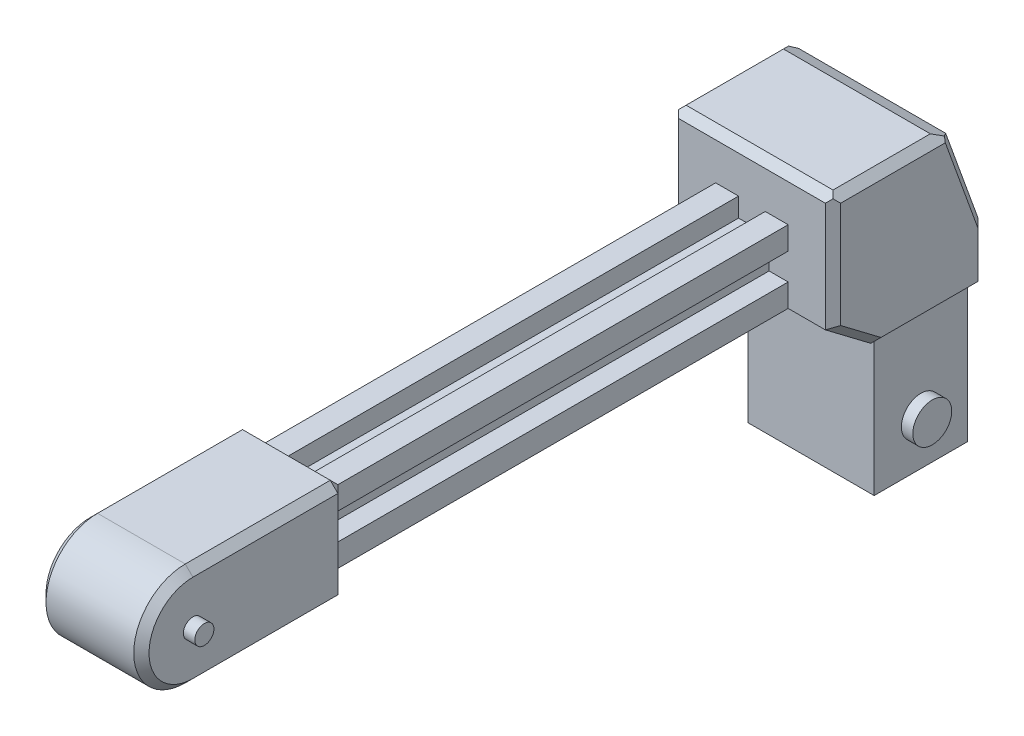
from build123d import *
from OCP.BRepFilletAPI import BRepFilletAPI_MakeChamfer

# Parameters (mm, degrees)
SKETCH_1_W          = 200
SKETCH_1_H          = 19
EXTRUDE_1_DEPTH     = 19
SKETCH_6_W          = 27
SKETCH_6_H          = 27
EXTRUDE_6_DEPTH     = 40
EXTRUDE_7_DEPTH     = 27
SKETCH_8_W          = 42.5
SKETCH_8_H          = 42.5
EXTRUDE_8_DEPTH     = 40
SKETCH_9_R          = 2.5
EXTRUDE_9_DEPTH     = 3
EXTRUDE_START       = 3
SKETCH_10_R         = 2.5
EXTRUDE_10_DEPTH    = 3
SKETCH_11_W         = 33
SKETCH_11_H         = 24.461700173
EXTRUDE_11_DEPTH    = 35
CUT_EXTRUDE_1_REACH = 211.742
CUT_EXTRUDE_2_DEPTH = 42.5
CUT_EXTRUDE_3_REACH = 222.711
SKETCH_15_W         = 120
SKETCH_15_H         = 7
CUT_EXTRUDE_4_DEPTH = 5
SKETCH_16_W         = 120
SKETCH_16_H         = 7
CUT_EXTRUDE_5_DEPTH = 5
SKETCH_17_W         = 7
SKETCH_17_H         = 120
CUT_EXTRUDE_6_DEPTH = 5
SKETCH_18_W         = 7
SKETCH_18_H         = 120
CUT_EXTRUDE_7_DEPTH = 5
CHAMFER_1_SIZE      = 2
CHAMFER_2_SIZE      = 2
CHAMFER_3_SIZE      = 2
CHAMFER_3_SIZE2     = 3.330930275
CHAMFER_4_SIZE      = 2
BOSS_EXTRUDE1_DEPTH = 3
BOSS_EXTRUDE2_START = 3
BOSS_EXTRUDE2_DEPTH = 3


with BuildPart() as part:
    # 草图1 → 凸台-拉伸1 (new body)
    with BuildSketch(Plane(origin=(0, 0, 0), x_dir=(0, 0, -1), z_dir=(1, 0, 0))):
        with Locations((100, 9.5)):
            Rectangle(SKETCH_1_W, SKETCH_1_H)
    extrude(amount=EXTRUDE_1_DEPTH)

    # 草图6 → 凸台-拉伸6 (add)
    with BuildSketch(Plane.XY):
        with Locations((9.5, 9.5)):
            Rectangle(SKETCH_6_W, SKETCH_6_H)
    extrude(amount=-EXTRUDE_6_DEPTH)

    # 草图7 → 凸台-拉伸7 (add)
    with BuildSketch(Plane(origin=(23, 0, 0), x_dir=(0, 0, -1), z_dir=(1, 0, 0))):
        with BuildLine():
            Line((0, -4), (0, 23))
            ThreePointArc((0, 23), (-13.5, 9.5), (0, -4))
        make_face()
    extrude(amount=-EXTRUDE_7_DEPTH)

    # 草图8 → 凸台-拉伸8 (add)
    with BuildSketch(Plane(origin=(0, 0, -200), x_dir=(-1, 0, 0), z_dir=(0, 0, -1))):
        with Locations((-9.5, 9.5)):
            Rectangle(SKETCH_8_W, SKETCH_8_H)
    extrude(amount=-EXTRUDE_8_DEPTH)

    # 草图9 → 凸台-拉伸9 (add)
    with BuildSketch(Plane(origin=(23, 0, 0), x_dir=(0, 0, -1), z_dir=(1, 0, 0))):
        with Locations((0, 9.5)):
            Circle(SKETCH_9_R)
    extrude(amount=EXTRUDE_9_DEPTH)

    # 草图10 → 凸台-拉伸10 (add)
    with BuildSketch(Plane.ZY.offset(4).offset(EXTRUDE_START)):
        with Locations(Location((0, 9.5, 0), (0, 0, 180))):
            Circle(SKETCH_10_R)
    extrude(amount=-EXTRUDE_10_DEPTH)

    # 草图11 → 凸台-拉伸11 (add)
    with BuildSketch(Plane.XZ.offset(11.75)):
        with Locations((9.5, -187.769149914)):
            Rectangle(SKETCH_11_W, SKETCH_11_H)
    extrude(amount=EXTRUDE_11_DEPTH)

    # 切除-拉伸1: up to this face of the body (flat: up to its plane)
    cut_extrude_1_end = Plane(part.part.faces().sort_by_distance((-11.75, 9.5, -180))[0])
    # 草图12 → 切除-拉伸1 (cut, up to the picked face)
    with BuildSketch(Plane(origin=(30.75, 0, 0), x_dir=(0, 0, -1), z_dir=(1, 0, 0)), mode=Mode.PRIVATE) as cut_extrude_1_sk1:
        Polygon((160, 0), (175.538299827, -11.75), (160, -11.75), align=None)
    cut_extrude_1_tool1 = split(extrude(cut_extrude_1_sk1.sketch, amount=-CUT_EXTRUDE_1_REACH, mode=Mode.PRIVATE), bisect_by=cut_extrude_1_end, keep=Keep.BOTH, mode=Mode.PRIVATE)
    add(cut_extrude_1_tool1.solids().sort_by(Axis((30.75, -7.833333, -165.179433), (-1, 0, 0)))[0], mode=Mode.SUBTRACT)

    # 草图13 → 切除-拉伸2 (cut)
    with BuildSketch(Plane.ZY.offset(11.75)):
        Polygon((-190.839141878, 30.75), (-200, 5.410999189), (-200, 30.75), align=None)
    extrude(amount=-CUT_EXTRUDE_2_DEPTH, mode=Mode.SUBTRACT)

    # 切除-拉伸3: up to this plane
    cut_extrude_3_end = Plane(origin=(-31.230792117, 0, -160), z_dir=(0, 0.7976215614630531, -0.603158225252082))
    # 草图14 → 切除-拉伸3 (cut, up to the surface)
    with BuildSketch(Plane(origin=(0, 0, -200), x_dir=(-1, 0, 0), z_dir=(0, 0, -1)), mode=Mode.PRIVATE) as cut_extrude_3_sk1:
        Polygon((-26, -11.75), (-30.75, -7), (-30.75, -11.75), align=None)
    cut_extrude_3_tool1 = split(extrude(cut_extrude_3_sk1.sketch, amount=-CUT_EXTRUDE_3_REACH, mode=Mode.PRIVATE), bisect_by=cut_extrude_3_end, keep=Keep.BOTH, mode=Mode.PRIVATE)
    add(cut_extrude_3_tool1.solids().sort_by_distance((29.166667, -10.166667, -200))[0], mode=Mode.SUBTRACT)
    # 草图14 → 切除-拉伸3 (cut, up to the surface)
    with BuildSketch(Plane(origin=(0, 0, -200), x_dir=(-1, 0, 0), z_dir=(0, 0, -1)), mode=Mode.PRIVATE) as cut_extrude_3_sk2:
        Polygon((7, -11.75), (11.75, -7), (11.75, -11.75), align=None)
    cut_extrude_3_tool2 = split(extrude(cut_extrude_3_sk2.sketch, amount=-CUT_EXTRUDE_3_REACH, mode=Mode.PRIVATE), bisect_by=cut_extrude_3_end, keep=Keep.BOTH, mode=Mode.PRIVATE)
    add(cut_extrude_3_tool2.solids().sort_by_distance((-10.166667, -10.166667, -200))[0], mode=Mode.SUBTRACT)

    # 草图15 → 切除-拉伸4 (cut)
    with BuildSketch(Plane.ZY):
        with Locations((-100, 9.5)):
            Rectangle(SKETCH_15_W, SKETCH_15_H)
    extrude(amount=-CUT_EXTRUDE_4_DEPTH, mode=Mode.SUBTRACT)

    # 草图16 → 切除-拉伸5 (cut)
    with BuildSketch(Plane(origin=(19, 0, 0), x_dir=(0, 0, -1), z_dir=(1, 0, 0))):
        with Locations((100, 9.5)):
            Rectangle(SKETCH_16_W, SKETCH_16_H)
    extrude(amount=-CUT_EXTRUDE_5_DEPTH, mode=Mode.SUBTRACT)

    # 草图17 → 切除-拉伸6 (cut)
    with BuildSketch(Plane.XZ):
        with Locations((9.5, -100)):
            Rectangle(SKETCH_17_W, SKETCH_17_H)
    extrude(amount=-CUT_EXTRUDE_6_DEPTH, mode=Mode.SUBTRACT)

    # 草图18 → 切除-拉伸7 (cut)
    with BuildSketch(Plane(origin=(0, 19, 0), x_dir=(1, 0, 0), z_dir=(0, 1, 0))):
        with Locations((9.5, 100)):
            Rectangle(SKETCH_18_W, SKETCH_18_H)
    extrude(amount=-CUT_EXTRUDE_7_DEPTH, mode=Mode.SUBTRACT)

    # 倒角1
    chamfer_1_edges = [part.edges().sort_by_distance(p)[0] for p in [
        (30.75, 18.080499595, -195.419570939),
        (30.75, -3.5, -164.628429736),
        (30.75, 15.375, -160),
        (30.75, 30.75, -175.419570939),
        (30.75, -0.794500405, -200),
    ]]
    chamfer(chamfer_1_edges, length=CHAMFER_1_SIZE)

    # 倒角2
    chamfer_2_edges = [part.edges().sort_by_distance(p)[0] for p in [
        (-11.75, -3.5, -164.628429736),
        (-11.75, -0.794500405, -200),
        (-11.75, 30.75, -175.419570939),
        (-11.75, 15.375, -160),
        (-11.75, 18.080499595, -195.419570939),
    ]]
    chamfer(chamfer_2_edges, length=CHAMFER_2_SIZE)

    # 倒角3: one chamfer whose edges measure the first distance from different faces: ONE call of the kernel's chamfer builder (chamfer() names one face for all edges)
    chamfer_3_edges_1 = [part.edges().sort_by_distance(p)[0] for p in [
        (9.5, 30.75, -190.839141878),
    ]]
    chamfer_3_side_1 = [part.faces().sort_by_distance(p)[0] for p in [
        (9.5, 18.080499595, -195.419570939),
    ]]
    chamfer_3_edges_2 = [part.edges().sort_by_distance(p)[0] for p in [
        (9.5, 30.75, -160),
    ]]
    chamfer_3 = BRepFilletAPI_MakeChamfer(part.part.solid().wrapped)
    for e in chamfer_3_edges_1:
        chamfer_3.Add(CHAMFER_3_SIZE, CHAMFER_3_SIZE2, e.wrapped, chamfer_3_side_1[0].wrapped)  # the first distance lies on this face
    for e in chamfer_3_edges_2:
        chamfer_3.Add(CHAMFER_3_SIZE, e.wrapped)
    add(Compound.cast(chamfer_3.Shape()), mode=Mode.REPLACE)

    # 倒角4
    chamfer_4_edges = [part.edges().sort_by_distance(p)[0] for p in [
        (23, 9.5, -40),
        (23, 23, -20),
        (9.5, -4, -40),
        (23, -4, -20),
        (-4, 9.5, -40),
        (-4, -4, -20),
        (9.5, 23, -40),
        (-4, 23, -20),
        (23, 9.5, 13.5),
        (-4, 9.5, 13.5),
    ]]
    chamfer(chamfer_4_edges, length=CHAMFER_4_SIZE)

    # Sketch2 → Boss-Extrude1 (add)
    with BuildSketch(Plane.ZY.offset(7)):
        with BuildLine():
            ThreePointArc((-182.669149914, -34.75), (-182.770150014, -33.740049506), (-183.069149914, -32.770101013))
            ThreePointArc((-183.069149914, -32.770101013), (-187.769149914, -29.65), (-192.469149914, -32.770101013))
            ThreePointArc((-192.469149914, -32.770101013), (-188.779100407, -39.7489999), (-182.669149914, -34.75))
        make_face()
    extrude(amount=BOSS_EXTRUDE1_DEPTH)

    # Sketch3 → Boss-Extrude2 (add)
    with BuildSketch(Plane(origin=(26, 0, 0), x_dir=(0, 0, -1), z_dir=(1, 0, 0)).offset(BOSS_EXTRUDE2_START)):
        with BuildLine():
            ThreePointArc((192.869149914, -34.75), (192.768149814, -33.740049506), (192.469149914, -32.770101013))
            ThreePointArc((192.469149914, -32.770101013), (187.769149914, -29.65), (183.069149914, -32.770101013))
            ThreePointArc((183.069149914, -32.770101013), (186.75919942, -39.7489999), (192.869149914, -34.75))
        make_face()
    extrude(amount=-BOSS_EXTRUDE2_DEPTH)


solid = part.part
